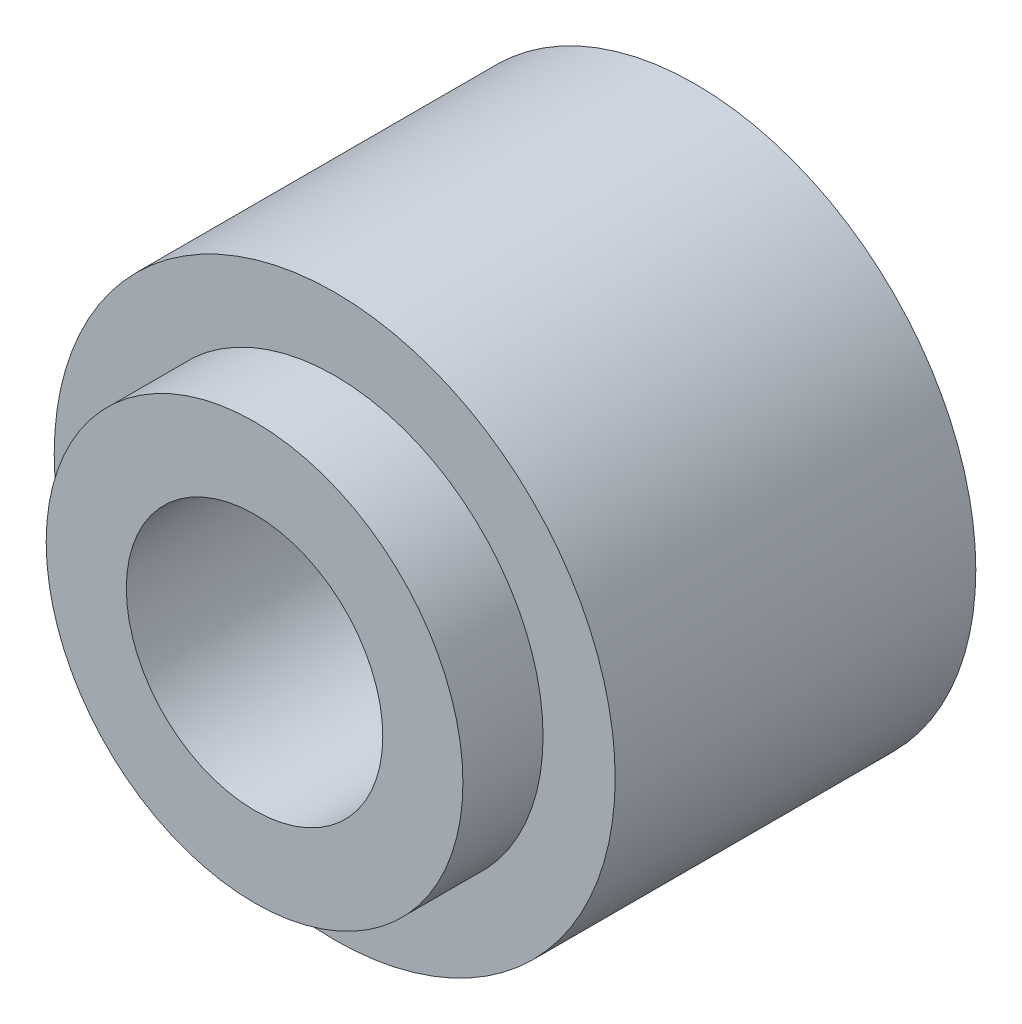
from build123d import *

# Parameters (mm, degrees)
SKETCH_1_R          = 3.5
SKETCH_1_R_2        = 1.6
EXTRUDE_1_DEPTH     = 5.5
SKETCH_2_OUTSIDE_W  = 11.264
SKETCH_2_OUTSIDE_H  = 11.264
SKETCH_2_OUTSIDE_R  = 2.6
CUT_EXTRUDE_1_DEPTH = 1


with BuildPart() as part:
    # Эскиз1 → Бобышка-Вытянуть1 (new body)
    with BuildSketch(Plane.XY):
        Circle(SKETCH_1_R)
        Circle(SKETCH_1_R_2, mode=Mode.SUBTRACT)
    extrude(amount=EXTRUDE_1_DEPTH)

    # Эскиз2 outside → Вырез-Вытянуть1 (cut)
    with BuildSketch(Plane.XY.offset(5.5)):
        Rectangle(SKETCH_2_OUTSIDE_W, SKETCH_2_OUTSIDE_H)
        Circle(SKETCH_2_OUTSIDE_R, mode=Mode.SUBTRACT)
    extrude(amount=-CUT_EXTRUDE_1_DEPTH, mode=Mode.SUBTRACT)


solid = part.part
